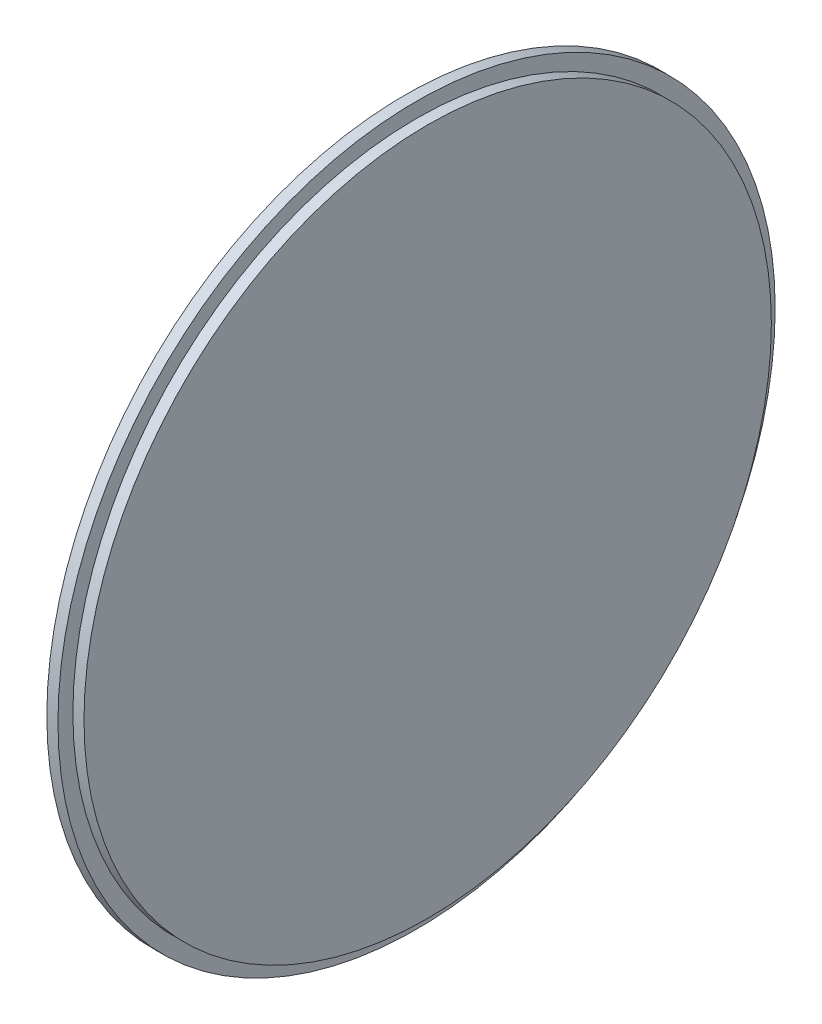
from build123d import *

# Parameters (mm, degrees)
SKETCH1_R           = 38.1
BOSS_EXTRUDE1_DEPTH = 1.1811
SKETCH2_R           = 36.5125
BOSS_EXTRUDE2_DEPTH = 1.1811


with BuildPart() as part:
    # Sketch1 → Boss-Extrude1 (new body)
    with BuildSketch(Plane.YZ):
        with Locations(Location((0, 0, 0), (0, 0, 270))):
            Circle(SKETCH1_R)
    extrude(amount=BOSS_EXTRUDE1_DEPTH)

    # Sketch2 → Boss-Extrude2 (add)
    with BuildSketch(Plane.YZ.offset(1.1811)):
        with Locations(Location((0, 0, 0), (0, 0, 270))):
            Circle(SKETCH2_R)
    extrude(amount=BOSS_EXTRUDE2_DEPTH)


solid = part.part
